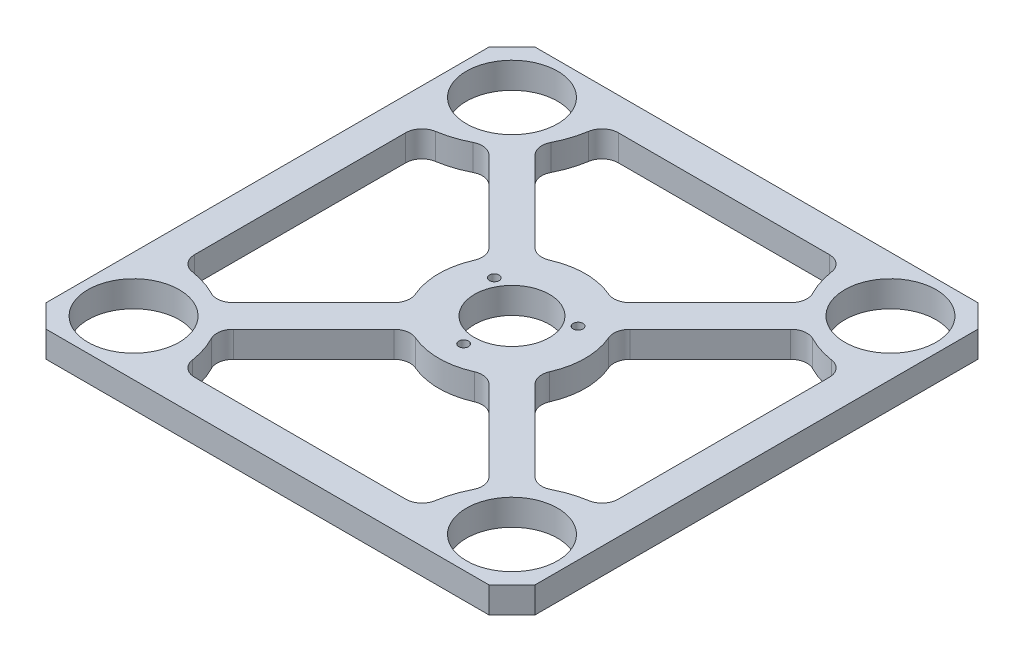
from build123d import *

# Parameters (mm, degrees)
SKETCH1_R           = 11.5
SKETCH1_R_2         = 14
SKETCH1_R_3         = 1.5
BOSS_EXTRUDE1_DEPTH = 4


with BuildPart() as part:
    # Sketch1 → Boss-Extrude1 (new, symmetric)
    with BuildSketch(Plane(origin=(0, 0, 0), x_dir=(1, 0, 0), z_dir=(0, 1, 0))):
        Polygon((-68, -75), (68, -75), (75, -68), (75, 68), (68, 75), (-68, 75), (-75, 68), (-75, -68), align=None)
        with Locations(Location((0, 0, 0), (0, 0, 270))):
            Circle(SKETCH1_R, mode=Mode.SUBTRACT)
        with Locations(Location((-58.064971157, 58.064971157, 0), (0, 0, 270))):
            Circle(SKETCH1_R_2, mode=Mode.SUBTRACT)
        with Locations(Location((58.064971157, 58.064971157, 0), (0, 0, 90))):
            Circle(SKETCH1_R_2, mode=Mode.SUBTRACT)
        with Locations(Location((58.064971157, -58.064971157, 0), (0, 0, 270))):
            Circle(SKETCH1_R_2, mode=Mode.SUBTRACT)
        with Locations(Location((-58.064971157, -58.064971157, 0), (0, 0, 90))):
            Circle(SKETCH1_R_2, mode=Mode.SUBTRACT)
        with Locations(Location((-12.85, 7.418950959, 0), (0, 0, 270))):
            Circle(SKETCH1_R_3, mode=Mode.SUBTRACT)
        with Locations(Location((12.85, 7.418950959, 0), (0, 0, 270))):
            Circle(SKETCH1_R_3, mode=Mode.SUBTRACT)
        with Locations(Location((0, -14.837901918, 0), (0, 0, 270))):
            Circle(SKETCH1_R_3, mode=Mode.SUBTRACT)
        with BuildLine():
            Line((-65, -32.380987139), (-65, 32.380987139))
            ThreePointArc((-65, 32.380987139), (-63.793934553, 35.637681876), (-60.757575758, 37.323261815))
            ThreePointArc((-60.757575758, 37.323261815), (-56.330087552, 38.376089353), (-52.1316343, 40.132246498))
            ThreePointArc((-52.1316343, 40.132246498), (-49.06707081, 40.632452823), (-46.298177948, 39.227110136))
            Line((-46.298177948, 39.227110136), (-21.649754839, 14.578687027))
            ThreePointArc((-21.649754839, 14.578687027), (-20.271607616, 11.968214073), (-20.606145336, 9.035307099))
            ThreePointArc((-20.606145336, 9.035307099), (-22.5, 0), (-20.606145336, -9.035307099))
            ThreePointArc((-20.606145336, -9.035307099), (-20.271607616, -11.968214073), (-21.649754839, -14.578687027))
            Line((-21.649754839, -14.578687027), (-46.298177948, -39.227110136))
            ThreePointArc((-46.298177948, -39.227110136), (-49.06707081, -40.632452823), (-52.1316343, -40.132246498))
            ThreePointArc((-52.1316343, -40.132246498), (-56.330087552, -38.376089353), (-60.757575758, -37.323261815))
            ThreePointArc((-60.757575758, -37.323261815), (-63.793934553, -35.637681876), (-65, -32.380987139))
        make_face(mode=Mode.SUBTRACT)
        with BuildLine():
            Line((-32.380987139, 65), (32.380987139, 65))
            ThreePointArc((32.380987139, 65), (35.637681876, 63.793934553), (37.323261815, 60.757575758))
            ThreePointArc((37.323261815, 60.757575758), (38.376089353, 56.330087552), (40.132246498, 52.1316343))
            ThreePointArc((40.132246498, 52.1316343), (40.632452823, 49.06707081), (39.227110136, 46.298177948))
            Line((39.227110136, 46.298177948), (14.578687027, 21.649754839))
            ThreePointArc((14.578687027, 21.649754839), (11.968214073, 20.271607616), (9.035307099, 20.606145336))
            ThreePointArc((9.035307099, 20.606145336), (0, 22.5), (-9.035307099, 20.606145336))
            ThreePointArc((-9.035307099, 20.606145336), (-11.968214073, 20.271607616), (-14.578687027, 21.649754839))
            Line((-14.578687027, 21.649754839), (-39.227110136, 46.298177948))
            ThreePointArc((-39.227110136, 46.298177948), (-40.632452823, 49.06707081), (-40.132246498, 52.1316343))
            ThreePointArc((-40.132246498, 52.1316343), (-38.376089353, 56.330087552), (-37.323261815, 60.757575758))
            ThreePointArc((-37.323261815, 60.757575758), (-35.637681876, 63.793934553), (-32.380987139, 65))
        make_face(mode=Mode.SUBTRACT)
        with BuildLine():
            Line((65, -32.380987139), (65, 32.380987139))
            ThreePointArc((65, 32.380987139), (63.793934553, 35.637681876), (60.757575758, 37.323261815))
            ThreePointArc((60.757575758, 37.323261815), (56.330087552, 38.376089353), (52.1316343, 40.132246498))
            ThreePointArc((52.1316343, 40.132246498), (49.06707081, 40.632452823), (46.298177948, 39.227110136))
            Line((46.298177948, 39.227110136), (21.649754839, 14.578687027))
            ThreePointArc((21.649754839, 14.578687027), (20.271607616, 11.968214073), (20.606145336, 9.035307099))
            ThreePointArc((20.606145336, 9.035307099), (22.5, 0), (20.606145336, -9.035307099))
            ThreePointArc((20.606145336, -9.035307099), (20.271607616, -11.968214073), (21.649754839, -14.578687027))
            Line((21.649754839, -14.578687027), (46.298177948, -39.227110136))
            ThreePointArc((46.298177948, -39.227110136), (49.06707081, -40.632452823), (52.1316343, -40.132246498))
            ThreePointArc((52.1316343, -40.132246498), (56.330087552, -38.376089353), (60.757575758, -37.323261815))
            ThreePointArc((60.757575758, -37.323261815), (63.793934553, -35.637681876), (65, -32.380987139))
        make_face(mode=Mode.SUBTRACT)
        with BuildLine():
            Line((-32.380987139, -65), (32.380987139, -65))
            ThreePointArc((32.380987139, -65), (35.637681876, -63.793934553), (37.323261815, -60.757575758))
            ThreePointArc((37.323261815, -60.757575758), (38.376089353, -56.330087552), (40.132246498, -52.1316343))
            ThreePointArc((40.132246498, -52.1316343), (40.632452823, -49.06707081), (39.227110136, -46.298177948))
            Line((39.227110136, -46.298177948), (14.578687027, -21.649754839))
            ThreePointArc((14.578687027, -21.649754839), (11.968214073, -20.271607616), (9.035307099, -20.606145336))
            ThreePointArc((9.035307099, -20.606145336), (0, -22.5), (-9.035307099, -20.606145336))
            ThreePointArc((-9.035307099, -20.606145336), (-11.968214073, -20.271607616), (-14.578687027, -21.649754839))
            Line((-14.578687027, -21.649754839), (-39.227110136, -46.298177948))
            ThreePointArc((-39.227110136, -46.298177948), (-40.632452823, -49.06707081), (-40.132246498, -52.1316343))
            ThreePointArc((-40.132246498, -52.1316343), (-38.376089353, -56.330087552), (-37.323261815, -60.757575758))
            ThreePointArc((-37.323261815, -60.757575758), (-35.637681876, -63.793934553), (-32.380987139, -65))
        make_face(mode=Mode.SUBTRACT)
    extrude(amount=BOSS_EXTRUDE1_DEPTH, both=True)


solid = part.part
